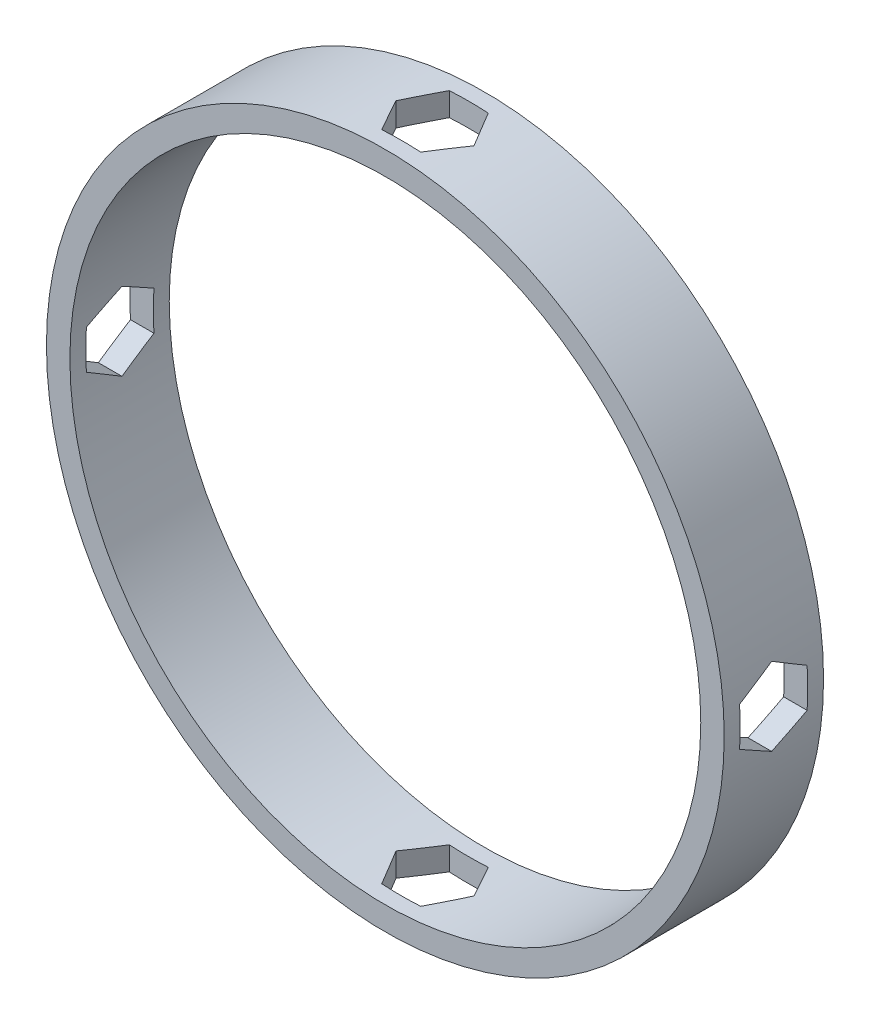
from build123d import *

# Parameters (mm, degrees)
SKETCH1_R           = 34.11
SKETCH1_R_2         = 31.75
BOSS_EXTRUDE1_DEPTH = 11.5
CUT_EXTRUDE1_DEPTH  = 10
CIRPATTERN2_COUNT   = 4
CUT_EXTRUDE2_START  = -1.5
SKETCH3_R           = 34.11
CUT_EXTRUDE2_DEPTH  = 1.5


with BuildPart() as part:
    # Sketch1 → Boss-Extrude1 (new body)
    with BuildSketch(Plane.XY):
        Circle(SKETCH1_R)
        Circle(SKETCH1_R_2, mode=Mode.SUBTRACT)
    extrude(amount=BOSS_EXTRUDE1_DEPTH)

    # Sketch2 → Cut-Extrude1 (cut)
    with BuildSketch(Plane(origin=(0, 34.11, 0), x_dir=(1, 0, 0), z_dir=(0, 1, 0))):
        Polygon((3.92598183, -5), (1.962990915, -1.6), (-1.962990915, -1.6), (-3.92598183, -5), (-1.962990915, -8.4), (1.962990915, -8.4), align=None)
    cut_extrude1 = extrude(amount=-CUT_EXTRUDE1_DEPTH, mode=Mode.SUBTRACT)

    # CirPattern2: Cut-Extrude1 ×4 about axis
    cirpattern2_axis = Axis((0, 0, 0), (0, 0, 1))
    for i in range(1, CIRPATTERN2_COUNT):
        add(cut_extrude1.rotate(cirpattern2_axis, i * 360 / CIRPATTERN2_COUNT), mode=Mode.SUBTRACT)

    # Sketch3 → Cut-Extrude2 (cut)
    with BuildSketch(Plane.XY.offset(11.5).offset(CUT_EXTRUDE2_START)):
        Circle(SKETCH3_R)
    extrude(amount=CUT_EXTRUDE2_DEPTH, mode=Mode.SUBTRACT)


solid = part.part
